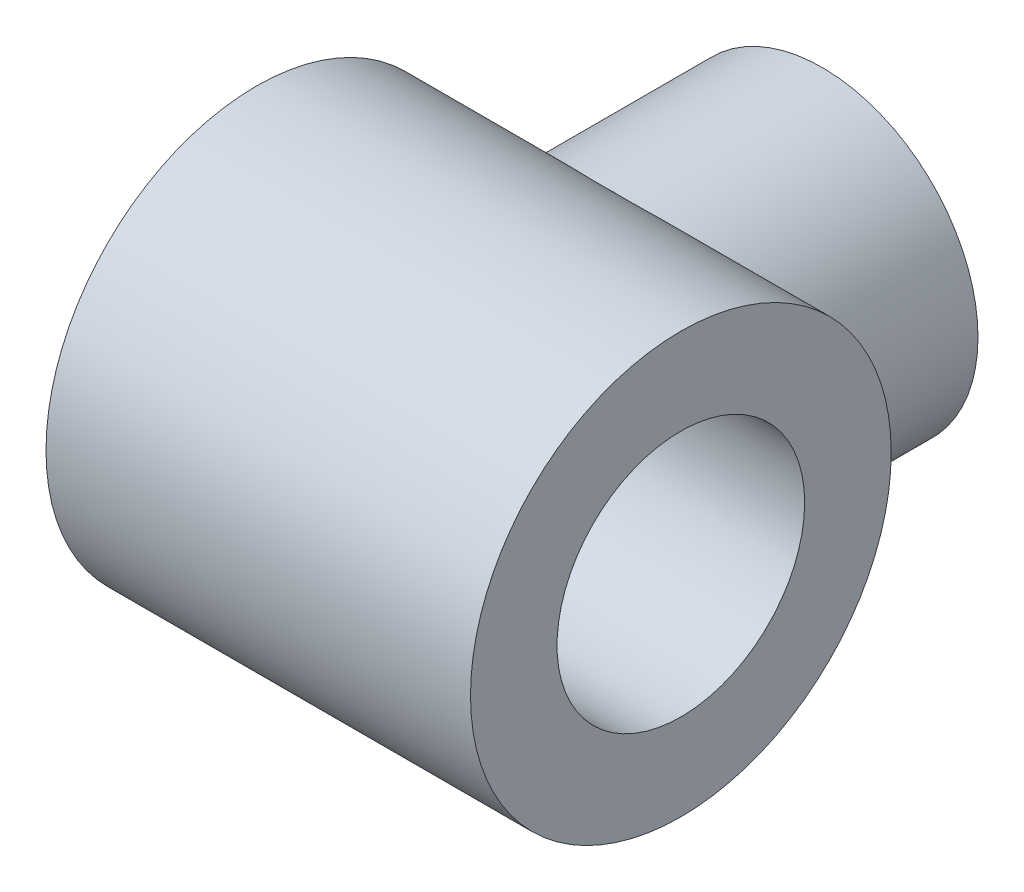
from build123d import *

# Parameters (mm, degrees)
SKETCH_1_R           = 2.2
SKETCH_1_R_2         = 1.2
EXTRUDE_1_DEPTH      = 3
EXTRUDE_2_DEPTH      = 3
EXTRUDE_2_DEPTH_BACK = 3
SKETCH_2_R           = 2.973213749
SKETCH_2_R_2         = 1.75


with BuildPart() as part:
    # 草图1 → 凸台-拉伸1 (new body)
    with BuildSketch(Plane.XY):
        Circle(SKETCH_1_R)
        Circle(SKETCH_1_R_2, mode=Mode.SUBTRACT)
    extrude(amount=EXTRUDE_1_DEPTH)


with BuildPart() as body_2:
    # 草图2 → 凸台-拉伸2 (new, two sides: drawn at the far end of the back side and taken through both)
    with BuildSketch(Plane(origin=(0, 0, 0), x_dir=(0, 0, -1), z_dir=(1, 0, 0)).offset(-EXTRUDE_2_DEPTH_BACK)):
        with Locations((-5, 0)):
            Circle(SKETCH_2_R)
        with Locations((-5, 0)):
            Circle(SKETCH_2_R_2, mode=Mode.SUBTRACT)
    extrude(amount=EXTRUDE_2_DEPTH + EXTRUDE_2_DEPTH_BACK)


solid = Compound([part.part, body_2.part])
